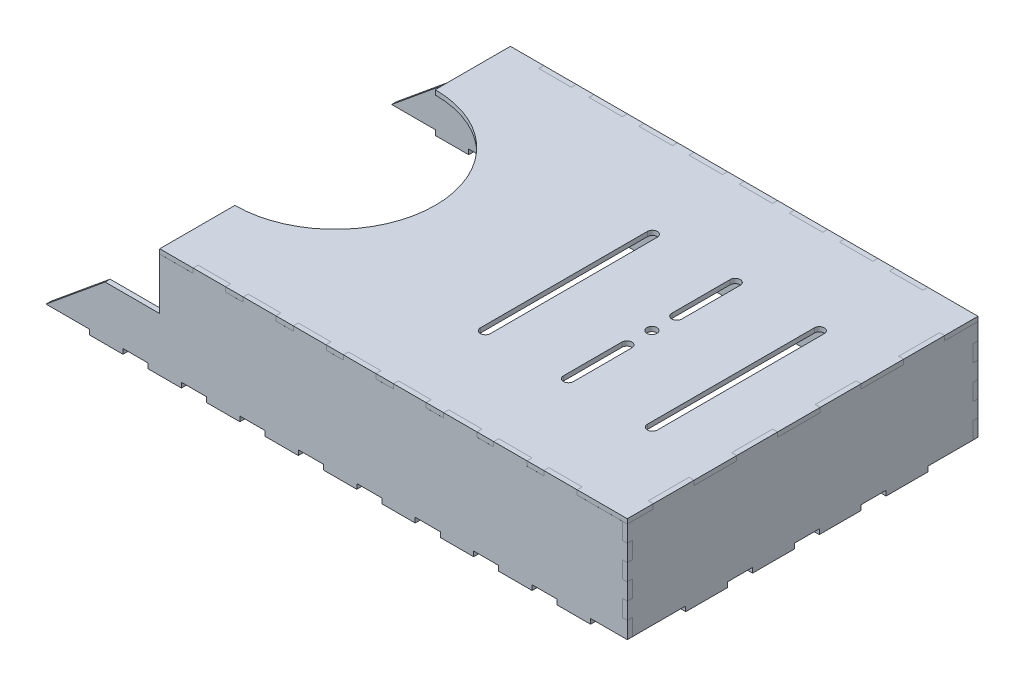
from build123d import *

# Parameters (mm, degrees)
SKETCH2_W                = 450
SKETCH2_H                = 275
BOSS_EXTRUDE1_DEPTH      = 6
SKETCH4_W                = 346
SKETCH4_H                = 210
SKETCH4_W_2              = 340
SKETCH4_H_2              = 204
EXTRUDE_THIN6_DEPTH      = 150
SKETCH11_W               = 346
SKETCH11_H               = 210
BOSS_EXTRUDE5_DEPTH      = 3
CUT_EXTRUDE4_DEPTH       = 399.5
SKETCH14_W               = 240.727508387
SKETCH14_H               = 210
BOSS_EXTRUDE8_DEPTH      = 3
SKETCH15_W               = 191.802039734
SKETCH15_H               = 23.205078546
CUT_EXTRUDE5_DEPTH       = 427.5
CUT_EXTRUDE6_DEPTH       = 138.5
CUT_EXTRUDE7_DEPTH       = 50
SKETCH18_R               = 3
CUT_EXTRUDE8_DEPTH       = 15.5
CUT_EXTRUDE10_DEPTH      = 253
BOSS_EXTRUDE9_DEPTH      = 210
CUT_EXTRUDE11_REACH      = 553.046
SKETCH23_W               = 553.459859496
SKETCH23_H               = 21.2517252
CUT_EXTRUDE19_DEPTH      = 452.030026609
CUT_EXTRUDE19_DEPTH_BACK = 452.030026609
SKETCH25_W               = 204
SKETCH25_H               = 152.143310348
CUT_EXTRUDE20_DEPTH      = 483.233118959
CUT_EXTRUDE20_DEPTH_BACK = 483.233118959
SKETCH27_W               = 6.887148853
SKETCH27_H               = 117.842527652
SKETCH29_W               = 210
SKETCH29_H               = 60
BOSS_EXTRUDE11_DEPTH     = 3
CUT_EXTRUDE22_DEPTH      = 451.757118627
CUT_EXTRUDE22_DEPTH_BACK = 451.757118627
SKETCH35_W               = 226.346168994
SKETCH35_H               = 97.53116916
SKETCH36_W               = 210.011178377
SKETCH36_H               = 3
BOSS_EXTRUDE16_DEPTH     = 280
CUT_EXTRUDE23_DEPTH      = 478.09189014
CUT_EXTRUDE23_DEPTH_BACK = 478.09189014
SKETCH37_R               = 60
BOSS_EXTRUDE17_START     = -3
SKETCH38_W               = 52.274547867
SKETCH38_H               = 30.871822273
BOSS_EXTRUDE17_DEPTH     = 3
BOSS_EXTRUDE18_START     = -3
SKETCH40_W               = 52.274547867
SKETCH40_H               = 30.871822273
BOSS_EXTRUDE18_DEPTH     = 3
CUT_EXTRUDE25_DEPTH      = 478.09189014
CUT_EXTRUDE25_DEPTH_BACK = 478.09189014
SKETCH41_R               = 3
SKETCH43_W               = 19.5
SKETCH43_H               = 3
CUT_EXTRUDE35_DEPTH      = 3.001
SKETCH45_W               = 3
SKETCH45_H               = 24.5
CUT_EXTRUDE36_DEPTH      = 3.001
CUT_EXTRUDE39_DEPTH      = 429.167221158
CUT_EXTRUDE39_DEPTH_BACK = 429.167221158
SKETCH49_W               = 215.214094431
SKETCH49_H               = 0.01
SKETCH50_W               = 24.5
SKETCH50_H               = 4.790672522
BOSS_EXTRUDE26_DEPTH     = 3
SKETCH51_W               = 20
SKETCH51_H               = 6.741204101
BOSS_EXTRUDE27_DEPTH     = 3
SKETCH52_W               = 20
SKETCH52_H               = 9.293874066
BOSS_EXTRUDE29_DEPTH     = 3
SKETCH53_W               = 3
SKETCH53_H               = 10
CUT_EXTRUDE40_DEPTH      = 3
SKETCH54_W               = 3
SKETCH54_H               = 10
BOSS_EXTRUDE30_DEPTH     = 3
SKETCH55_W               = 3
SKETCH55_H               = 10
BOSS_EXTRUDE31_DEPTH     = 3
SKETCH56_W               = 218.544292149
SKETCH56_H               = 12.86319653
CUT_EXTRUDE41_DEPTH      = 322
SKETCH59_W               = 20
SKETCH59_H               = 3
BOSS_EXTRUDE32_DEPTH     = 210
SKETCH60_W               = 204
SKETCH60_H               = 4.832000411
CUT_EXTRUDE42_DEPTH      = 322
SKETCH61_W               = 25
SKETCH61_H               = 3
BOSS_EXTRUDE34_DEPTH     = 3


with BuildPart() as part:
    # Sketch2 → Boss-Extrude1 (new body)
    with BuildSketch(Plane(origin=(0, 0, 0), x_dir=(1, 0, 0), z_dir=(0, 1, 0))):
        with Locations((225, 137.5)):
            Rectangle(SKETCH2_W, SKETCH2_H)
    extrude(amount=BOSS_EXTRUDE1_DEPTH)

    # Sketch4 → Extrude-Thin6 (add)
    with BuildSketch(Plane(origin=(0, 6, 0), x_dir=(1, 0, 0), z_dir=(0, 1, 0))):
        with Locations((230, 137.5)):
            Rectangle(SKETCH4_W, SKETCH4_H)
        with Locations((230, 137.5)):
            Rectangle(SKETCH4_W_2, SKETCH4_H_2, mode=Mode.SUBTRACT)
    extrude(amount=EXTRUDE_THIN6_DEPTH)

    # Sketch11 → Boss-Extrude5 (add)
    with BuildSketch(Plane(origin=(0, 156, 0), x_dir=(1, 0, 0), z_dir=(0, 1, 0))):
        with Locations((230, 137.5)):
            Rectangle(SKETCH11_W, SKETCH11_H)
    extrude(amount=BOSS_EXTRUDE5_DEPTH)

    # Sketch12 → Cut-Extrude4 (cut, symmetric)
    with BuildSketch(Plane.XY.offset(-32.5)):
        Polygon((57, 6), (57, 159), (242.851374206, 159), align=None)
    extrude(amount=CUT_EXTRUDE4_DEPTH, both=True, mode=Mode.SUBTRACT)

    # Sketch14 → Boss-Extrude8 (add)
    with BuildSketch(Plane(origin=(20.081221644, -24.39295842, 0), x_dir=(0.7720404512600452, 0.635573395933299, 0), z_dir=(-0.6355733959332989, 0.7720404512600451, 0))):
        with Locations((168.183500291, 137.5)):
            Rectangle(SKETCH14_W, SKETCH14_H)
    extrude(amount=BOSS_EXTRUDE8_DEPTH)

    # Sketch15 → Cut-Extrude5 (cut, symmetric)
    with BuildSketch(Plane(origin=(0, 0, -242.5), x_dir=(-1, 0, 0), z_dir=(0, 0, -1))):
        with Locations((-307.098980133, 170.602539273)):
            Rectangle(SKETCH15_W, SKETCH15_H)
    extrude(amount=CUT_EXTRUDE5_DEPTH, both=True, mode=Mode.SUBTRACT)

    # Sketch16 → Cut-Extrude6 (cut, symmetric)
    with BuildSketch(Plane.XY.offset(-137.5)):
        Polygon((93.281387285, 39.754040327), (178.274547867, 39.754040327), (178.274547867, 109.723679371), align=None)
    extrude(amount=CUT_EXTRUDE6_DEPTH, both=True, mode=Mode.SUBTRACT)

    # Sketch17 → Cut-Extrude7 (cut, symmetric)
    with BuildSketch(Plane.XY.offset(-137.5)):
        Polygon((106.168507706, 112.371541346), (106.168507706, 6), (-67.742553851, 6), align=None)
    extrude(amount=CUT_EXTRUDE7_DEPTH, both=True, mode=Mode.SUBTRACT)

    # Sketch18 → Cut-Extrude8 (cut, symmetric)
    with BuildSketch(Plane.XZ):
        with Locations(Location((120, -47.5, 0), (0, 0, 270))):
            Circle(SKETCH18_R)
        with Locations(Location((225, -47.5, 0), (0, 0, 270))):
            Circle(SKETCH18_R)
        with Locations(Location((330, -47.5, 0), (0, 0, 270))):
            Circle(SKETCH18_R)
        with Locations(Location((330, -227.5, 0), (0, 0, 270))):
            Circle(SKETCH18_R)
        with Locations(Location((225, -227.5, 0), (0, 0, 270))):
            Circle(SKETCH18_R)
        with Locations(Location((120, -227.5, 0), (0, 0, 270))):
            Circle(SKETCH18_R)
    extrude(amount=CUT_EXTRUDE8_DEPTH, both=True, mode=Mode.SUBTRACT)

    # Sketch19 → Cut-Extrude10 (cut)
    with BuildSketch(Plane.XY.offset(-32.5)):
        Polygon((403, 159), (343.143320884, 159), (403, 109.723679371), align=None)
    extrude(amount=-CUT_EXTRUDE10_DEPTH, mode=Mode.SUBTRACT)

    # Sketch22 → Boss-Extrude9 (add)
    with BuildSketch(Plane.XY.offset(-32.5)):
        Polygon((343.143320884, 159), (403, 109.723679371), (403.635573396, 110.495719822), (343.77889428, 159.772040451), align=None)
    extrude(amount=-BOSS_EXTRUDE9_DEPTH)

    # Cut-Extrude11: up to this face of the body (flat: up to its plane)
    cut_extrude11_end = Plane(part.part.faces().sort_by_distance((450, 3, -137.5))[0])
    # Sketch23 → Cut-Extrude11 (cut, up to the picked face)
    with BuildSketch(Plane.ZY, mode=Mode.PRIVATE) as cut_extrude11_sk1:
        with Locations((-275, 0)):
            Rectangle(SKETCH23_W, SKETCH23_H)
    cut_extrude11_tool1 = split(extrude(cut_extrude11_sk1.sketch, amount=-CUT_EXTRUDE11_REACH, mode=Mode.PRIVATE), bisect_by=cut_extrude11_end, keep=Keep.BOTH, mode=Mode.PRIVATE)
    add(cut_extrude11_tool1.solids().sort_by(Axis((0, 0, -275), (1, 0, 0)))[0], mode=Mode.SUBTRACT)

    # Sketch25 → Cut-Extrude19 (cut, two sides: drawn at the far end of the back side and taken through both)
    with BuildSketch(Plane(origin=(403, 0, 0), x_dir=(0, 0, -1), z_dir=(1, 0, 0)).offset(-CUT_EXTRUDE19_DEPTH_BACK)):
        with Locations((137.5, 86.697517774)):
            Rectangle(SKETCH25_W, SKETCH25_H)
    extrude(amount=CUT_EXTRUDE19_DEPTH + CUT_EXTRUDE19_DEPTH_BACK, mode=Mode.SUBTRACT)


with BuildPart() as cut_extrude19_piece_1:
    # of the separate pieces the step leaves, piece 1, a body of its own (cut_extrude19_pieces)
    add(part.part.solids().sort_by_distance((178.274547867, 39.754040327, -35.5))[0])


with BuildPart() as cut_extrude19_piece_2:
    # of the separate pieces the step leaves, piece 2, a body of its own (cut_extrude19_pieces)
    add(part.part.solids().sort_by_distance((403, 10.6258626, -239.5))[0])


with BuildPart() as cut_extrude20_tool:
    # Sketch27 → Cut-Extrude20 (new, two sides: drawn at the far end of the back side and taken through both)
    with BuildSketch(Plane(origin=(0, 0, -242.5), x_dir=(-1, 0, 0), z_dir=(0, 0, -1)).offset(-CUT_EXTRUDE20_DEPTH_BACK)):
        with Locations((-406.443574427, 69.547126426)):
            Rectangle(SKETCH27_W, SKETCH27_H)
        Polygon((-238.131226982, 159), (-377.142708736, 159), (-373.634375866, 174.856347085), (-234.860320131, 174.856347085), align=None)
    extrude(amount=CUT_EXTRUDE20_DEPTH + CUT_EXTRUDE20_DEPTH_BACK)


with BuildPart() as cut_extrude19_piece_1_1:
    add(cut_extrude19_piece_1.part)

    # Cut-Extrude20: cut by cut_extrude20_tool
    add(cut_extrude20_tool.part, mode=Mode.SUBTRACT)


with BuildPart() as cut_extrude19_piece_2_1:
    add(cut_extrude19_piece_2.part)

    # Cut-Extrude20: cut by cut_extrude20_tool
    add(cut_extrude20_tool.part, mode=Mode.SUBTRACT)


with BuildPart() as body_3:
    # Sketch29 → Boss-Extrude11 (new body)
    with BuildSketch(Plane(origin=(403, 0, 0), x_dir=(0, 0, -1), z_dir=(1, 0, 0))):
        with Locations((137.5, 40.6258626)):
            Rectangle(SKETCH29_W, SKETCH29_H)
    extrude(amount=BOSS_EXTRUDE11_DEPTH)


with BuildPart() as cut_extrude22_tool:
    # Sketch35 → Cut-Extrude22 (new, two sides: drawn at the far end of the back side and taken through both)
    with BuildSketch(Plane(origin=(403, 0, 0), x_dir=(0, 0, -1), z_dir=(1, 0, 0)).offset(-CUT_EXTRUDE22_DEPTH_BACK)):
        with Locations((145.673084497, 119.39144718)):
            Rectangle(SKETCH35_W, SKETCH35_H)
    extrude(amount=CUT_EXTRUDE22_DEPTH + CUT_EXTRUDE22_DEPTH_BACK)


with BuildPart() as cut_extrude19_piece_1_2:
    add(cut_extrude19_piece_1_1.part)

    # Cut-Extrude22: cut by cut_extrude22_tool
    add(cut_extrude22_tool.part, mode=Mode.SUBTRACT)



with BuildPart() as cut_extrude19_piece_2_2:
    add(cut_extrude19_piece_2_1.part)

    # Cut-Extrude22: cut by cut_extrude22_tool
    add(cut_extrude22_tool.part, mode=Mode.SUBTRACT)


with BuildPart() as body_4:
    # Sketch36 → Boss-Extrude16 (new body)
    with BuildSketch(Plane(origin=(406, 0, 0), x_dir=(0, 0, -1), z_dir=(1, 0, 0))):
        with Locations((137.505589189, 72.1258626)):
            Rectangle(SKETCH36_W, SKETCH36_H)
    extrude(amount=-BOSS_EXTRUDE16_DEPTH)

    # Sketch37 → Cut-Extrude23 (cut, two sides: drawn at the far end of the back side and taken through both)
    with BuildSketch(Plane(origin=(0, 73.6258626, 0), x_dir=(1, 0, 0), z_dir=(0, 1, 0)).offset(-CUT_EXTRUDE23_DEPTH_BACK)):
        with Locations((126, 137.505589188)):
            Circle(SKETCH37_R)
    extrude(amount=CUT_EXTRUDE23_DEPTH + CUT_EXTRUDE23_DEPTH_BACK, mode=Mode.SUBTRACT)


with BuildPart() as cut_extrude19_piece_1_3:
    add(cut_extrude19_piece_1_2.part)

    add(body_4.part)  # Boss-Extrude17 merges body 4
    # Sketch38 → Boss-Extrude17 (add)
    with BuildSketch(Plane.XY.offset(-32.5).offset(BOSS_EXTRUDE17_START)):
        with Locations((152.137273934, 55.189951464)):
            Rectangle(SKETCH38_W, SKETCH38_H)
    extrude(amount=BOSS_EXTRUDE17_DEPTH)


    add(cut_extrude19_piece_2_2.part)  # Boss-Extrude18 merges Cut-Extrude19 piece 2
    # Sketch40 → Boss-Extrude18 (add)
    with BuildSketch(Plane(origin=(0, 0, -242.5), x_dir=(-1, 0, 0), z_dir=(0, 0, -1)).offset(BOSS_EXTRUDE18_START)):
        with Locations((-152.137273934, 55.189951464)):
            Rectangle(SKETCH40_W, SKETCH40_H)
    extrude(amount=BOSS_EXTRUDE18_DEPTH)

    # Sketch41 → Cut-Extrude25 (cut, two sides: drawn at the far end of the back side and taken through both)
    with BuildSketch(Plane(origin=(0, 73.6258626, 0), x_dir=(1, 0, 0), z_dir=(0, 1, 0)).offset(-CUT_EXTRUDE25_DEPTH_BACK)):
        with Locations(Location((315.749923636, 137.505589188, 0), (0, 0, 270))):
            Circle(SKETCH41_R)
        with BuildLine():
            Line((263, 87.505589188), (263, 187.505589188))
            ThreePointArc((263, 187.505589188), (266, 190.505589188), (269, 187.505589188))
            Line((269, 187.505589188), (269, 87.505589188))
            ThreePointArc((269, 87.505589188), (266, 84.505589188), (263, 87.505589188))
        make_face()
        with BuildLine():
            Line((363, 87.505589188), (363, 187.505589188))
            ThreePointArc((363, 187.505589188), (366, 190.505589188), (369, 187.505589188))
            Line((369, 187.505589188), (369, 87.505589188))
            ThreePointArc((369, 87.505589188), (366, 84.505589188), (363, 87.505589188))
        make_face()
        with BuildLine():
            Line((318.749923636, 187.377232258), (318.749923636, 152.377232258))
            ThreePointArc((318.749923636, 152.377232258), (315.749923636, 149.377232258), (312.749923636, 152.377232258))
            Line((312.749923636, 152.377232258), (312.749923636, 187.377232258))
            ThreePointArc((312.749923636, 187.377232258), (315.749923636, 190.377232258), (318.749923636, 187.377232258))
        make_face()
        with BuildLine():
            Line((318.749923636, 122.505589188), (318.749923636, 87.505589188))
            ThreePointArc((318.749923636, 87.505589188), (315.749923636, 84.505589188), (312.749923636, 87.505589188))
            Line((312.749923636, 87.505589188), (312.749923636, 122.505589188))
            ThreePointArc((312.749923636, 122.505589188), (315.749923636, 125.505589188), (318.749923636, 122.505589188))
        make_face()
    extrude(amount=CUT_EXTRUDE25_DEPTH + CUT_EXTRUDE25_DEPTH_BACK, mode=Mode.SUBTRACT)

    # Sketch43 → Cut-Extrude35 (cut)
    with BuildSketch(Plane(origin=(0, 73.6258626, 0), x_dir=(1, 0, 0), z_dir=(0, 1, 0))):
        with Locations((155.75, 241.011178377)):
            Rectangle(SKETCH43_W, SKETCH43_H)
        with Locations((185.75, 241.011178377)):
            Rectangle(SKETCH43_W, SKETCH43_H)
        with Locations((215.75, 241.011178377)):
            Rectangle(SKETCH43_W, SKETCH43_H)
        with Locations((245.75, 241.011178377)):
            Rectangle(SKETCH43_W, SKETCH43_H)
        with Locations((275.75, 241.011178377)):
            Rectangle(SKETCH43_W, SKETCH43_H)
        with Locations((305.75, 241.011178377)):
            Rectangle(SKETCH43_W, SKETCH43_H)
        with Locations((335.75, 241.011178377)):
            Rectangle(SKETCH43_W, SKETCH43_H)
        with Locations((365.75, 241.011178377)):
            Rectangle(SKETCH43_W, SKETCH43_H)
        with Locations((365.75, 34)):
            Rectangle(SKETCH43_W, SKETCH43_H)
        with Locations((335.75, 34)):
            Rectangle(SKETCH43_W, SKETCH43_H)
        with Locations((305.75, 34)):
            Rectangle(SKETCH43_W, SKETCH43_H)
        with Locations((275.75, 34)):
            Rectangle(SKETCH43_W, SKETCH43_H)
        with Locations((245.75, 34)):
            Rectangle(SKETCH43_W, SKETCH43_H)
        with Locations((215.75, 34)):
            Rectangle(SKETCH43_W, SKETCH43_H)
        with Locations((185.75, 34)):
            Rectangle(SKETCH43_W, SKETCH43_H)
        with Locations((155.75, 34)):
            Rectangle(SKETCH43_W, SKETCH43_H)
    extrude(amount=-CUT_EXTRUDE35_DEPTH, mode=Mode.SUBTRACT)


with BuildPart() as cut_extrude36_tool:
    # Sketch45 → Cut-Extrude36 (new body)
    with BuildSketch(Plane(origin=(0, 73.6258626, 0), x_dir=(1, 0, 0), z_dir=(0, 1, 0))):
        with Locations((404.5, 210.261178377)):
            Rectangle(SKETCH45_W, SKETCH45_H)
        with Locations((404.5, 160.261178377)):
            Rectangle(SKETCH45_W, SKETCH45_H)
        with Locations((404.5, 110.261178377)):
            Rectangle(SKETCH45_W, SKETCH45_H)
        with Locations((404.5, 60.261178377)):
            Rectangle(SKETCH45_W, SKETCH45_H)
    extrude(amount=-CUT_EXTRUDE36_DEPTH)


with BuildPart() as cut_extrude19_piece_1_4:
    add(cut_extrude19_piece_1_3.part)

    # Cut-Extrude36: cut by cut_extrude36_tool
    add(cut_extrude36_tool.part, mode=Mode.SUBTRACT)

    # Sketch49 → Cut-Extrude39 (cut, two sides: drawn at the far end of the back side and taken through both)
    with BuildSketch(Plane(origin=(403, 0, 0), x_dir=(0, 0, -1), z_dir=(1, 0, 0)).offset(-CUT_EXTRUDE39_DEPTH_BACK)):
        with Locations((140.107047216, 70.6208626)):
            Rectangle(SKETCH49_W, SKETCH49_H)
    extrude(amount=CUT_EXTRUDE39_DEPTH + CUT_EXTRUDE39_DEPTH_BACK, mode=Mode.SUBTRACT)


with BuildPart() as body_3_1:
    add(body_3.part)

    # Cut-Extrude36: cut by cut_extrude36_tool
    add(cut_extrude36_tool.part, mode=Mode.SUBTRACT)

    # Sketch50 → Boss-Extrude26 (add)
    with BuildSketch(Plane(origin=(406, 0, 0), x_dir=(0, 0, -1), z_dir=(1, 0, 0))):
        with Locations((160.261178377, 71.230526339)):
            Rectangle(SKETCH50_W, SKETCH50_H)
        with Locations((210.261178377, 71.230526339)):
            Rectangle(SKETCH50_W, SKETCH50_H)
        with Locations((110.261178377, 71.230526339)):
            Rectangle(SKETCH50_W, SKETCH50_H)
        with Locations((60.261178377, 71.230526339)):
            Rectangle(SKETCH50_W, SKETCH50_H)
    extrude(amount=-BOSS_EXTRUDE26_DEPTH)

    # Sketch53 → Cut-Extrude40 (cut)
    with BuildSketch(Plane(origin=(406, 0, 0), x_dir=(0, 0, -1), z_dir=(1, 0, 0))):
        with Locations((241, 55.6258626)):
            Rectangle(SKETCH53_W, SKETCH53_H)
        with Locations((241, 35.6258626)):
            Rectangle(SKETCH53_W, SKETCH53_H)
        with Locations((241, 15.6258626)):
            Rectangle(SKETCH53_W, SKETCH53_H)
        with Locations((34, 15.6258626)):
            Rectangle(SKETCH53_W, SKETCH53_H)
        with Locations((34, 35.6258626)):
            Rectangle(SKETCH53_W, SKETCH53_H)
        with Locations((34, 55.6258626)):
            Rectangle(SKETCH53_W, SKETCH53_H)
    extrude(amount=-CUT_EXTRUDE40_DEPTH, mode=Mode.SUBTRACT)


with BuildPart() as cut_extrude39_piece_1:
    # of the separate pieces the step leaves, piece 1, a body of its own (cut_extrude39_pieces)
    add(cut_extrude19_piece_1_4.part.solids().sort_by_distance((406, 70.6258626, -32.5))[0])


with BuildPart() as cut_extrude39_piece_2:
    # of the separate pieces the step leaves, piece 2, a body of its own (cut_extrude39_pieces)
    add(cut_extrude19_piece_1_4.part.solids().sort_by_distance((93.281387285, 39.754040327, -35.5))[0])

    # Sketch52 → Boss-Extrude29 (add)
    with BuildSketch(Plane.XY.offset(-32.5)):
        with Locations((366, 71.474165461)):
            Rectangle(SKETCH52_W, SKETCH52_H)
        with Locations((336, 71.474165461)):
            Rectangle(SKETCH52_W, SKETCH52_H)
        with Locations((306, 71.474165461)):
            Rectangle(SKETCH52_W, SKETCH52_H)
        with Locations((276, 71.474165461)):
            Rectangle(SKETCH52_W, SKETCH52_H)
        with Locations((246, 71.474165461)):
            Rectangle(SKETCH52_W, SKETCH52_H)
        with Locations((216, 71.474165461)):
            Rectangle(SKETCH52_W, SKETCH52_H)
        with Locations((186, 71.474165461)):
            Rectangle(SKETCH52_W, SKETCH52_H)
        with Locations((156, 71.474165461)):
            Rectangle(SKETCH52_W, SKETCH52_H)
    extrude(amount=-BOSS_EXTRUDE29_DEPTH)

    # Sketch55 → Boss-Extrude31 (add)
    with BuildSketch(Plane.XY.offset(-32.5)):
        with Locations((404.5, 35.6258626)):
            Rectangle(SKETCH55_W, SKETCH55_H)
        with Locations((404.5, 55.6258626)):
            Rectangle(SKETCH55_W, SKETCH55_H)
        with Locations((404.5, 15.6258626)):
            Rectangle(SKETCH55_W, SKETCH55_H)
    extrude(amount=-BOSS_EXTRUDE31_DEPTH)


with BuildPart() as cut_extrude39_piece_3:
    # of the separate pieces the step leaves, piece 3, a body of its own (cut_extrude39_pieces)
    add(cut_extrude19_piece_1_4.part.solids().sort_by_distance((57.898956836, 10.6258626, -239.5))[0])

    # Sketch51 → Boss-Extrude27 (add)
    with BuildSketch(Plane(origin=(0, 0, -242.5), x_dir=(-1, 0, 0), z_dir=(0, 0, -1))):
        with Locations((-366, 71.713340415)):
            Rectangle(SKETCH51_W, SKETCH51_H)
        with Locations((-336, 71.713340415)):
            Rectangle(SKETCH51_W, SKETCH51_H)
        with Locations((-306, 71.713340415)):
            Rectangle(SKETCH51_W, SKETCH51_H)
        with Locations((-276, 71.713340415)):
            Rectangle(SKETCH51_W, SKETCH51_H)
        with Locations((-246, 71.713340415)):
            Rectangle(SKETCH51_W, SKETCH51_H)
        with Locations((-216, 71.713340415)):
            Rectangle(SKETCH51_W, SKETCH51_H)
        with Locations((-186, 71.713340415)):
            Rectangle(SKETCH51_W, SKETCH51_H)
        with Locations((-156, 71.713340415)):
            Rectangle(SKETCH51_W, SKETCH51_H)
    extrude(amount=-BOSS_EXTRUDE27_DEPTH)

    # Sketch54 → Boss-Extrude30 (add)
    with BuildSketch(Plane(origin=(0, 0, -242.5), x_dir=(-1, 0, 0), z_dir=(0, 0, -1))):
        with Locations((-404.5, 35.6258626)):
            Rectangle(SKETCH54_W, SKETCH54_H)
        with Locations((-404.5, 55.6258626)):
            Rectangle(SKETCH54_W, SKETCH54_H)
        with Locations((-404.5, 15.6258626)):
            Rectangle(SKETCH54_W, SKETCH54_H)
    extrude(amount=-BOSS_EXTRUDE30_DEPTH)


with BuildPart() as cut_extrude39_piece_1_1:
    # Body-Move/Copy10: moved
    add(cut_extrude39_piece_1.part.moved(Location((0, 20, 0))))


with BuildPart() as cut_extrude39_piece_1_2:
    # Body-Move/Copy14: moved
    add(cut_extrude39_piece_1_1.part.moved(Location((0, -20, 0))))


with BuildPart() as cut_extrude41_tool:
    # Sketch56 → Cut-Extrude41 (new body)
    with BuildSketch(Plane(origin=(406, 0, 0), x_dir=(0, 0, -1), z_dir=(1, 0, 0))):
        with Locations((141.772146075, 79.800080812)):
            Rectangle(SKETCH56_W, SKETCH56_H)
    extrude(amount=-CUT_EXTRUDE41_DEPTH)


with BuildPart() as body_3_2:
    add(body_3_1.part)

    # Cut-Extrude41: cut by cut_extrude41_tool
    add(cut_extrude41_tool.part, mode=Mode.SUBTRACT)

    # Sketch61 → Boss-Extrude34 (add)
    with BuildSketch(Plane(origin=(406, 0, 0), x_dir=(0, 0, -1), z_dir=(1, 0, 0))):
        with Locations((200, 9.1258626)):
            Rectangle(SKETCH61_W, SKETCH61_H)
        with Locations((160, 9.1258626)):
            Rectangle(SKETCH61_W, SKETCH61_H)
        with Locations((120, 9.1258626)):
            Rectangle(SKETCH61_W, SKETCH61_H)
        with Locations((80, 9.1258626)):
            Rectangle(SKETCH61_W, SKETCH61_H)
    extrude(amount=-BOSS_EXTRUDE34_DEPTH)


with BuildPart() as cut_extrude39_piece_1_3:
    add(cut_extrude39_piece_1_2.part)

    # Cut-Extrude41: cut by cut_extrude41_tool
    add(cut_extrude41_tool.part, mode=Mode.SUBTRACT)


with BuildPart() as cut_extrude39_piece_2_1:
    add(cut_extrude39_piece_2.part)

    # Cut-Extrude41: cut by cut_extrude41_tool
    add(cut_extrude41_tool.part, mode=Mode.SUBTRACT)



with BuildPart() as cut_extrude39_piece_3_1:
    add(cut_extrude39_piece_3.part)

    # Cut-Extrude41: cut by cut_extrude41_tool
    add(cut_extrude41_tool.part, mode=Mode.SUBTRACT)


with BuildPart() as cut_extrude39_piece_2_2:
    add(cut_extrude39_piece_2_1.part)

    add(cut_extrude39_piece_3_1.part)  # Boss-Extrude32 merges Cut-Extrude39 piece 3
    # Sketch59 → Boss-Extrude32 (add)
    with BuildSketch(Plane.XY.offset(-32.5)):
        with Locations((129, 9.1258626)):
            Rectangle(SKETCH59_W, SKETCH59_H)
        with Locations((94, 9.1258626)):
            Rectangle(SKETCH59_W, SKETCH59_H)
        with Locations((164, 9.1258626)):
            Rectangle(SKETCH59_W, SKETCH59_H)
        with Locations((199, 9.1258626)):
            Rectangle(SKETCH59_W, SKETCH59_H)
        with Locations((234, 9.1258626)):
            Rectangle(SKETCH59_W, SKETCH59_H)
        with Locations((269, 9.1258626)):
            Rectangle(SKETCH59_W, SKETCH59_H)
        with Locations((304, 9.1258626)):
            Rectangle(SKETCH59_W, SKETCH59_H)
        with Locations((339, 9.1258626)):
            Rectangle(SKETCH59_W, SKETCH59_H)
        with Locations((374, 9.1258626)):
            Rectangle(SKETCH59_W, SKETCH59_H)
    extrude(amount=-BOSS_EXTRUDE32_DEPTH)

    # Sketch60 → Cut-Extrude42 (cut)
    with BuildSketch(Plane(origin=(384, 0, 0), x_dir=(0, 0, -1), z_dir=(1, 0, 0))):
        with Locations((137.5, 8.209862394)):
            Rectangle(SKETCH60_W, SKETCH60_H)
    extrude(amount=-CUT_EXTRUDE42_DEPTH, mode=Mode.SUBTRACT)


with BuildPart() as cut_extrude42_piece_1:
    # of the separate pieces the step leaves, piece 1, a body of its own (cut_extrude42_pieces)
    add(cut_extrude39_piece_2_2.part.solids().sort_by_distance((93.281387285, 39.754040327, -35.5))[0])


with BuildPart() as cut_extrude42_piece_2:
    # of the separate pieces the step leaves, piece 2, a body of its own (cut_extrude42_pieces)
    add(cut_extrude39_piece_2_2.part.solids().sort_by_distance((57.898956836, 10.6258626, -239.5))[0])


solid = Compound([body_3_2.part, cut_extrude39_piece_1_3.part, cut_extrude42_piece_1.part, cut_extrude42_piece_2.part])
